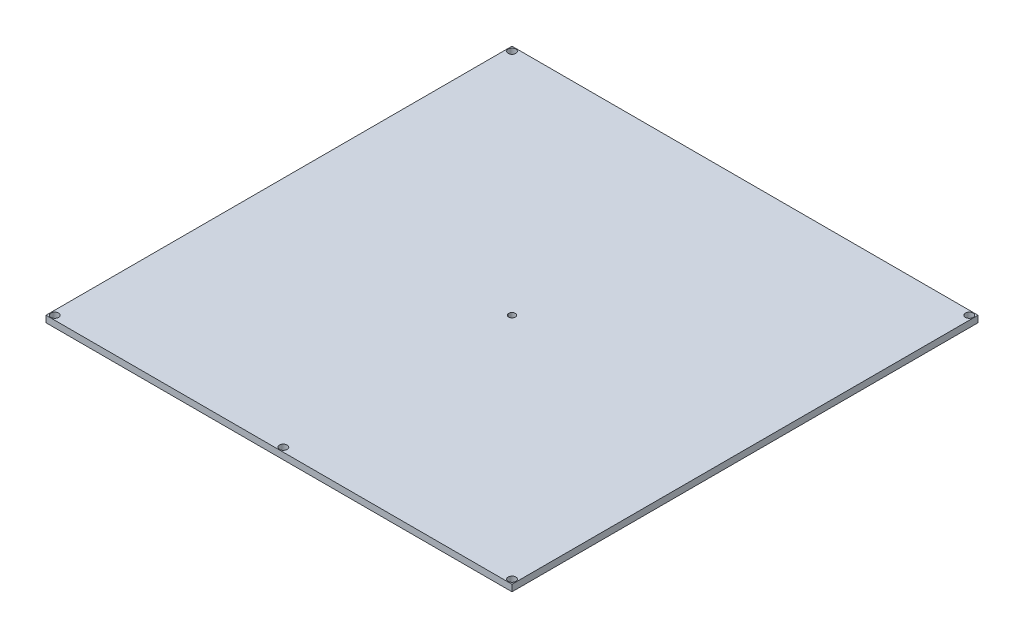
from build123d import *

# Parameters (mm, degrees)
SKETCH1_W           = 213
SKETCH1_H           = 213
SKETCH1_R           = 1.75
SKETCH1_R_2         = 1.5
BOSS_EXTRUDE1_DEPTH = 3


with BuildPart() as part:
    # Sketch1 → Boss-Extrude1 (new body)
    with BuildSketch(Plane(origin=(0, 0, 0), x_dir=(1, 0, 0), z_dir=(0, 1, 0))):
        Rectangle(SKETCH1_W, SKETCH1_H)
        with Locations(Location((-104.5, 104.5, 0), (0, 0, 270))):
            Circle(SKETCH1_R, mode=Mode.SUBTRACT)
        with Locations(Location((104.5, 104.5, 0), (0, 0, 270))):
            Circle(SKETCH1_R, mode=Mode.SUBTRACT)
        with Locations(Location((-104.5, -104.5, 0), (0, 0, 270))):
            Circle(SKETCH1_R, mode=Mode.SUBTRACT)
        with Locations(Location((104.5, -104.5, 0), (0, 0, 270))):
            Circle(SKETCH1_R, mode=Mode.SUBTRACT)
        with Locations(Location((0, -104.5, 0), (0, 0, 270))):
            Circle(SKETCH1_R, mode=Mode.SUBTRACT)
        with Locations(Location((0, 0, 0), (0, 0, 270))):
            Circle(SKETCH1_R_2, mode=Mode.SUBTRACT)
    extrude(amount=BOSS_EXTRUDE1_DEPTH)


solid = part.part
